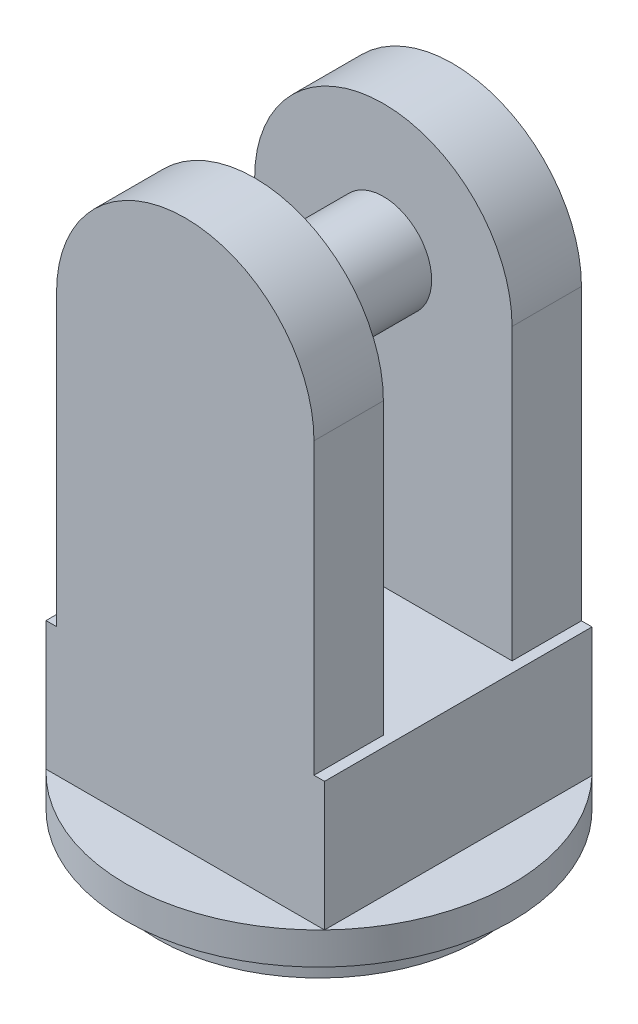
from build123d import *

# Parameters (mm, degrees)
SKETCH1_R            = 50
BOSS_EXTRUDE1_DEPTH  = 10
SKETCH2_R            = 15
CUT_EXTRUDE1_DEPTH   = 10
SKETCH3_R            = 60
BOSS_EXTRUDE2_DEPTH  = 10
SKETCH4_W            = 86.5466222
SKETCH4_H            = 83.124498108
BOSS_EXTRUDE3_DEPTH  = 40
BOSS_EXTRUDE9_DEPTH  = 83.124498108
SKETCH16_W           = 40
SKETCH16_H           = 180
CUT_EXTRUDE6_DEPTH   = 1000
SKETCH17_R           = 15
BOSS_EXTRUDE10_DEPTH = 61.562249054


with BuildPart() as part:
    # Sketch1 → Boss-Extrude1 (new body)
    with BuildSketch(Plane(origin=(0, 0, 0), x_dir=(1, 0, 0), z_dir=(0, 1, 0))):
        with Locations(Location((0, 0, 0), (0, 0, 270))):
            Circle(SKETCH1_R)
    extrude(amount=BOSS_EXTRUDE1_DEPTH)

    # Sketch2 → Cut-Extrude1 (cut)
    with BuildSketch(Plane(origin=(0, 10, 0), x_dir=(1, 0, 0), z_dir=(0, 1, 0))):
        with Locations(Location((0, 0, 0), (0, 0, 270))):
            Circle(SKETCH2_R)
    extrude(amount=-CUT_EXTRUDE1_DEPTH, mode=Mode.SUBTRACT)

    # Sketch3 → Boss-Extrude2 (add)
    with BuildSketch(Plane(origin=(0, 10, 0), x_dir=(1, 0, 0), z_dir=(0, 1, 0))):
        with Locations(Location((0, 0, 0), (0, 0, 270))):
            Circle(SKETCH3_R)
    extrude(amount=BOSS_EXTRUDE2_DEPTH)

    # Sketch4 → Boss-Extrude3 (add)
    with BuildSketch(Plane(origin=(0, 20, 0), x_dir=(1, 0, 0), z_dir=(0, 1, 0))):
        Rectangle(SKETCH4_W, SKETCH4_H)
    extrude(amount=BOSS_EXTRUDE3_DEPTH)

    # Sketch15 → Boss-Extrude9 (add)
    with BuildSketch(Plane.XY.offset(41.562249054)):
        with BuildLine():
            Line((-40, 60), (-40, 150))
            ThreePointArc((-40, 150), (0, 190), (40, 150))
            Line((40, 150), (40, 60))
            ThreePointArc((40, 60), (0, 20), (-40, 60))
        make_face()
    extrude(amount=-BOSS_EXTRUDE9_DEPTH)

    # Sketch16 → Cut-Extrude6 (cut)
    with BuildSketch(Plane.ZY.offset(40)):
        with Locations((0, 150)):
            Rectangle(SKETCH16_W, SKETCH16_H)
    extrude(amount=-CUT_EXTRUDE6_DEPTH, mode=Mode.SUBTRACT)

    # Sketch17 → Boss-Extrude10 (add)
    with BuildSketch(Plane.XY.offset(41.562249054)):
        with Locations((0, 150)):
            Circle(SKETCH17_R)
    extrude(amount=-BOSS_EXTRUDE10_DEPTH)


solid = part.part
